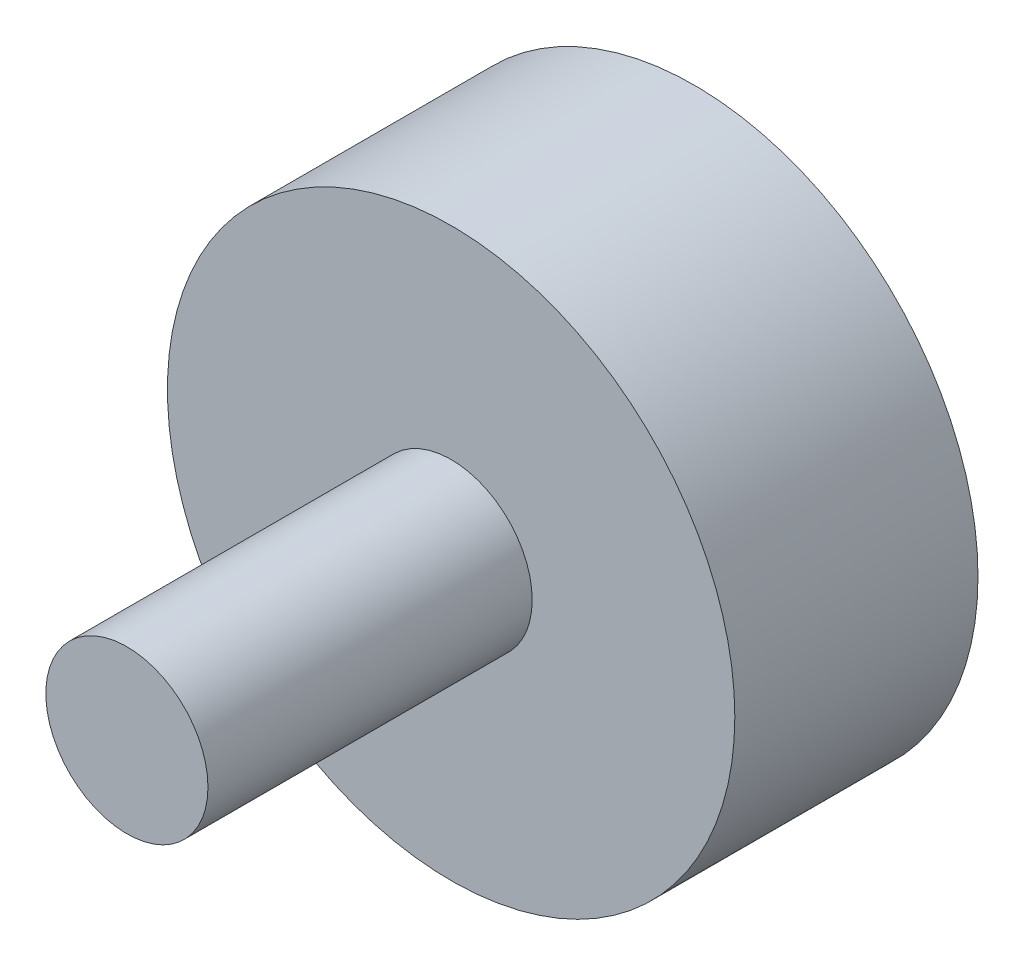
from build123d import *

# Parameters (mm, degrees)
SKETCH1_R           = 3.5
BOSS_EXTRUDE1_DEPTH = 3
SKETCH2_R           = 1
BOSS_EXTRUDE2_DEPTH = 4


with BuildPart() as part:
    # Sketch1 → Boss-Extrude1 (new body)
    with BuildSketch(Plane.XY):
        Circle(SKETCH1_R)
    extrude(amount=BOSS_EXTRUDE1_DEPTH)

    # Sketch2 → Boss-Extrude2 (add)
    with BuildSketch(Plane.XY.offset(3)):
        Circle(SKETCH2_R)
    extrude(amount=BOSS_EXTRUDE2_DEPTH)


solid = part.part
